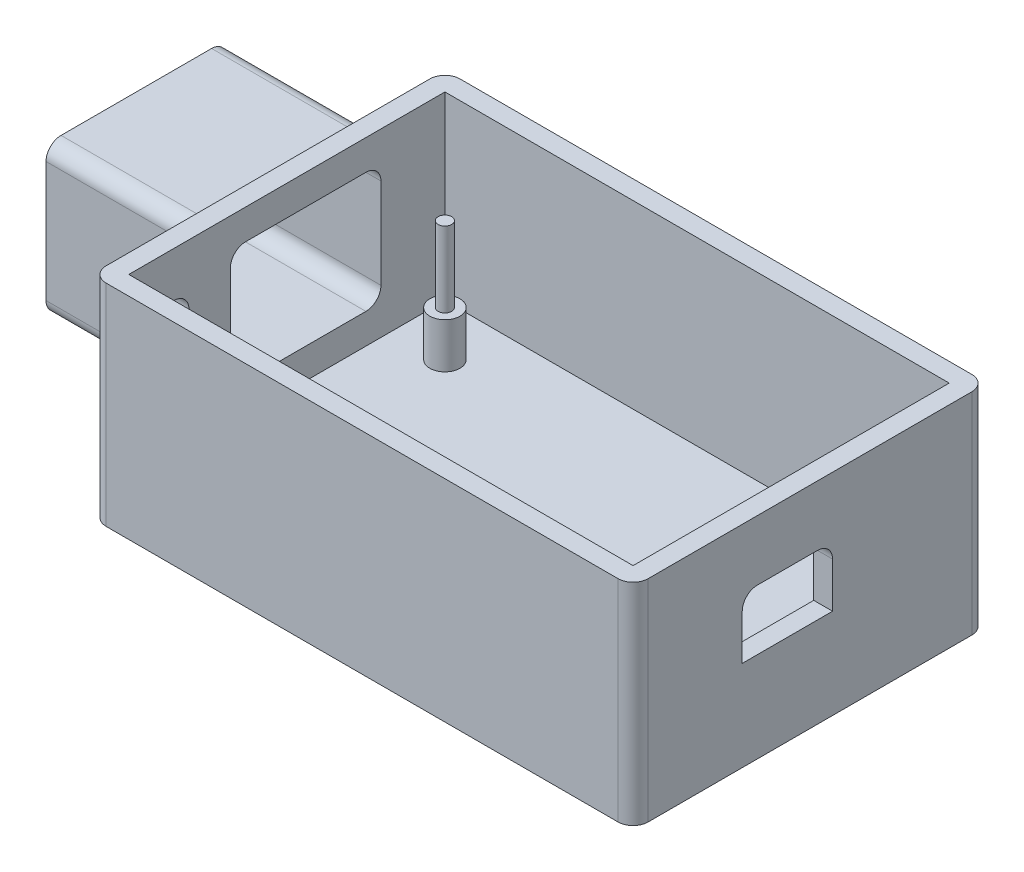
from build123d import *

# Parameters (mm, degrees)
SKETCH1_W           = 72
SKETCH1_H           = 47
BOSS_EXTRUDE1_DEPTH = 4
SKETCH3_W           = 72
SKETCH3_H           = 47
SKETCH3_W_2         = 67
SKETCH3_H_2         = 42
BOSS_EXTRUDE3_DEPTH = 24
SKETCH2_R           = 0.9
BOSS_EXTRUDE4_DEPTH = 16
SKETCH4_R           = 2
BOSS_EXTRUDE5_DEPTH = 6
SKETCH5_W           = 12
SKETCH5_H           = 8
CUT_EXTRUDE1_DEPTH  = 6
FILLET2_R           = 2
FILLET3_R           = 2
SKETCH11_W          = 24
SKETCH11_H          = 20
BOSS_EXTRUDE7_DEPTH = 20
SKETCH12_W          = 20
SKETCH12_H          = 16
CUT_EXTRUDE4_DEPTH  = 20
SKETCH13_W          = 15
SKETCH13_H          = 9
CUT_EXTRUDE5_DEPTH  = 20
FILLET4_R           = 2
FILLET5_R           = 2
SKETCH14_W          = 6
SKETCH14_H          = 14
CUT_EXTRUDE6_DEPTH  = 5
FILLET6_R           = 2


with BuildPart() as part:
    # Sketch1 → Boss-Extrude1 (new body)
    with BuildSketch(Plane(origin=(0, 0, 0), x_dir=(1, 0, 0), z_dir=(0, 1, 0))):
        with Locations((25.5, 13)):
            Rectangle(SKETCH1_W, SKETCH1_H)
    extrude(amount=BOSS_EXTRUDE1_DEPTH)

    # Sketch3 → Boss-Extrude3 (add)
    with BuildSketch(Plane(origin=(0, 4, 0), x_dir=(1, 0, 0), z_dir=(0, 1, 0))):
        with Locations((25.5, 13)):
            Rectangle(SKETCH3_W, SKETCH3_H)
        with Locations((25.5, 13)):
            Rectangle(SKETCH3_W_2, SKETCH3_H_2, mode=Mode.SUBTRACT)
    extrude(amount=BOSS_EXTRUDE3_DEPTH)

    # Sketch2 → Boss-Extrude4 (add)
    with BuildSketch(Plane(origin=(0, 4, 0), x_dir=(1, 0, 0), z_dir=(0, 1, 0))):
        with Locations(Location((-1.2, 27.2, 0), (0, 0, 270))):
            Circle(SKETCH2_R)
        with Locations(Location((-1.2, -1.2, 0), (0, 0, 90))):
            Circle(SKETCH2_R)
        with Locations(Location((52.2, -1.2, 0), (0, 0, 270))):
            Circle(SKETCH2_R)
        with Locations(Location((52.2, 27.2, 0), (0, 0, 90))):
            Circle(SKETCH2_R)
    extrude(amount=BOSS_EXTRUDE4_DEPTH)

    # Sketch4 → Boss-Extrude5 (add)
    with BuildSketch(Plane(origin=(0, 4, 0), x_dir=(1, 0, 0), z_dir=(0, 1, 0))):
        with Locations(Location((-1.2, 27.2, 0), (0, 0, 270))):
            Circle(SKETCH4_R)
        with Locations(Location((-1.2, -1.2, 0), (0, 0, 90))):
            Circle(SKETCH4_R)
        with Locations(Location((52.2, -1.2, 0), (0, 0, 270))):
            Circle(SKETCH4_R)
        with Locations(Location((52.2, 27.2, 0), (0, 0, 90))):
            Circle(SKETCH4_R)
    extrude(amount=BOSS_EXTRUDE5_DEPTH)

    # Sketch5 → Cut-Extrude1 (cut)
    with BuildSketch(Plane(origin=(61.5, 0, 0), x_dir=(0, 0, -1), z_dir=(1, 0, 0))):
        with Locations((10, 16)):
            Rectangle(SKETCH5_W, SKETCH5_H)
    extrude(amount=-CUT_EXTRUDE1_DEPTH, mode=Mode.SUBTRACT)

    # Fillet2
    fillet2_edges = [part.edges().sort_by_distance(p)[0] for p in [
        (-10.5, 14, 10.5),
        (-10.5, 14, -36.5),
        (61.5, 14, -36.5),
        (61.5, 14, 10.5),
    ]]
    fillet(fillet2_edges, radius=FILLET2_R)

    # Fillet3
    fillet3_edges = [part.edges().sort_by_distance(p)[0] for p in [
        (60.25, 20, -4),
        (60.25, 20, -16),
    ]]
    fillet(fillet3_edges, radius=FILLET3_R)

    # Sketch11 → Boss-Extrude7 (add)
    with BuildSketch(Plane.ZY.offset(10.5)):
        with Locations((-15.5, 16)):
            Rectangle(SKETCH11_W, SKETCH11_H)
    extrude(amount=BOSS_EXTRUDE7_DEPTH)

    # Sketch12 → Cut-Extrude4 (cut)
    with BuildSketch(Plane(origin=(-8, 0, 0), x_dir=(0, 0, -1), z_dir=(1, 0, 0))):
        with Locations((15.5, 16)):
            Rectangle(SKETCH12_W, SKETCH12_H)
    extrude(amount=-CUT_EXTRUDE4_DEPTH, mode=Mode.SUBTRACT)

    # Sketch13 → Cut-Extrude5 (cut)
    with BuildSketch(Plane.ZY.offset(30.5)):
        with Locations((-15.5, 16)):
            Rectangle(SKETCH13_W, SKETCH13_H)
    extrude(amount=-CUT_EXTRUDE5_DEPTH, mode=Mode.SUBTRACT)

    # Fillet4
    fillet4_edges = [part.edges().sort_by_distance(p)[0] for p in [
        (-18, 8, -25.5),
        (-18, 8, -5.5),
        (-18, 24, -5.5),
        (-18, 24, -25.5),
    ]]
    fillet(fillet4_edges, radius=FILLET4_R)

    # Fillet5
    fillet5_edges = [part.edges().sort_by_distance(p)[0] for p in [
        (-20.5, 26, -27.5),
        (-20.5, 6, -27.5),
        (-20.5, 6, -3.5),
        (-20.5, 26, -3.5),
    ]]
    fillet(fillet5_edges, radius=FILLET5_R)

    # Sketch14 → Cut-Extrude6 (cut)
    with BuildSketch(Plane.ZY.offset(10.5)):
        with Locations((3, 15)):
            Rectangle(SKETCH14_W, SKETCH14_H)
    extrude(amount=-CUT_EXTRUDE6_DEPTH, mode=Mode.SUBTRACT)

    # Fillet6
    fillet6_edges = [part.edges().sort_by_distance(p)[0] for p in [
        (-9.25, 8, 0),
        (-9.25, 22, 0),
        (-9.25, 22, 6),
        (-9.25, 8, 6),
    ]]
    fillet(fillet6_edges, radius=FILLET6_R)


solid = part.part
